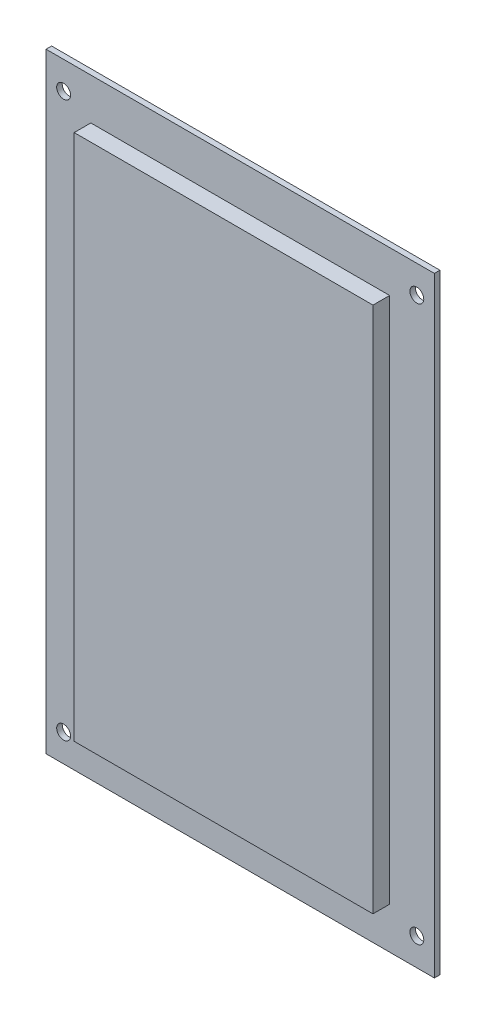
from build123d import *

# Parameters (mm, degrees)
SKETCH2_W           = 53.86
SKETCH2_H           = 95.04
BOSS_EXTRUDE1_DEPTH = 3
SKETCH3_W           = 70
SKETCH3_H           = 110
SKETCH3_R           = 1.25
BOSS_EXTRUDE2_DEPTH = 1


with BuildPart() as part:
    # Sketch2 → Boss-Extrude1 (new body)
    with BuildSketch(Plane.XY):
        with Locations((6.912993197, -3.934965986)):
            Rectangle(SKETCH2_W, SKETCH2_H)
    extrude(amount=BOSS_EXTRUDE1_DEPTH)

    # Sketch3 → Boss-Extrude2 (add)
    with BuildSketch(Plane(origin=(0, 0, 0), x_dir=(-1, 0, 0), z_dir=(0, 0, -1))):
        with Locations((-6.912993197, -3.934965986)):
            Rectangle(SKETCH3_W, SKETCH3_H)
        with Locations((24.922942909, 46.09293361)):
            Circle(SKETCH3_R, mode=Mode.SUBTRACT)
        with Locations((24.922942909, -53.962865582)):
            Circle(SKETCH3_R, mode=Mode.SUBTRACT)
        with Locations(Location((-38.748929304, 46.09293361, 0), (0, 0, 180))):
            Circle(SKETCH3_R, mode=Mode.SUBTRACT)
        with Locations(Location((-38.748929304, -53.962865582, 0), (0, 0, 180))):
            Circle(SKETCH3_R, mode=Mode.SUBTRACT)
    extrude(amount=BOSS_EXTRUDE2_DEPTH)


solid = part.part
